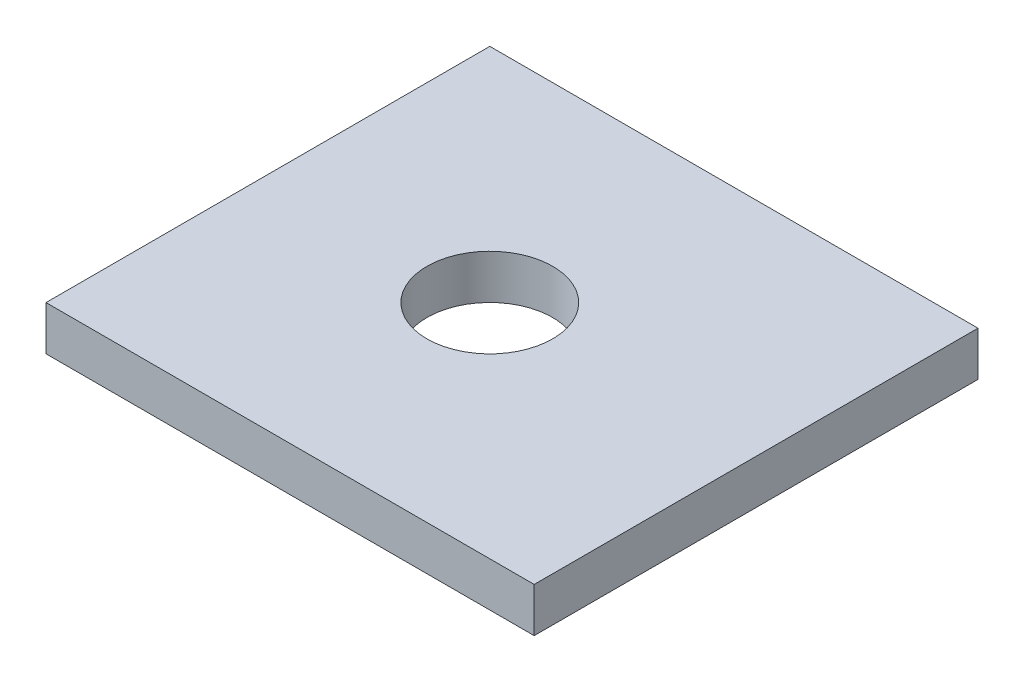
from build123d import *

# Parameters (mm, degrees)
CROQUIS1_W              = 33
CROQUIS1_H              = 30
SALIENTE_EXTRUIR1_DEPTH = 3
CROQUIS2_R              = 4.25
CORTAR_EXTRUIR1_DEPTH   = 3


with BuildPart() as part:
    # Croquis1 → Saliente-Extruir1 (new body)
    with BuildSketch(Plane(origin=(0, 0, 0), x_dir=(1, 0, 0), z_dir=(0, 1, 0))):
        Rectangle(CROQUIS1_W, CROQUIS1_H)
    extrude(amount=SALIENTE_EXTRUIR1_DEPTH)

    # Croquis2 → Cortar-Extruir1 (cut)
    with BuildSketch(Plane(origin=(0, 3, 0), x_dir=(1, 0, 0), z_dir=(0, 1, 0))):
        with Locations(Location((-1.5, 0, 0), (0, 0, 270))):
            Circle(CROQUIS2_R)
    extrude(amount=-CORTAR_EXTRUIR1_DEPTH, mode=Mode.SUBTRACT)


solid = part.part
